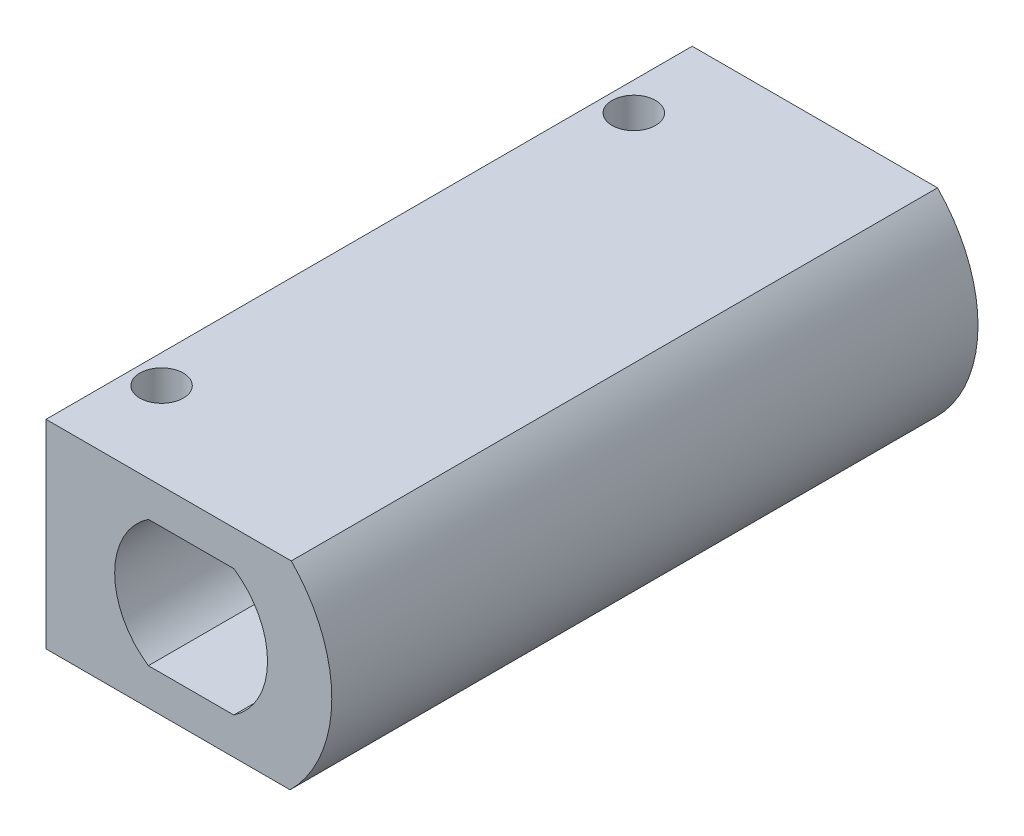
from build123d import *

# Parameters (mm, degrees)
SALIENTE_EXTRUIR1_DEPTH = 52
CROQUIS3_W              = 0.615681901
CROQUIS3_H              = 16
SALIENTE_EXTRUIR2_DEPTH = 52
CROQUIS2_R              = 1.75
CORTAR_EXTRUIR1_DEPTH   = 52
SALIENTE_EXTRUIR3_START = -52
SALIENTE_EXTRUIR3_DEPTH = 52
CROQUIS4_W              = 6.89100463
CROQUIS4_H              = 7.9059588
CORTAR_EXTRUIR2_DEPTH   = 10


with BuildPart() as part:
    # Croquis1 → Saliente-Extruir1 (new body)
    with BuildSketch(Plane.XY):
        with BuildLine():
            Line((-3.032251305, 15.708802589), (-22.152251305, 15.708802589))
            Line((-22.152251305, 15.708802589), (-22.152251305, -0.291197411))
            Line((-22.152251305, -0.291197411), (-3.132125677, -0.291197411))
            ThreePointArc((-3.132125677, -0.291197411), (-3.082032439, -0.241353267), (-3.032251305, -0.191197411))
            ThreePointArc((-3.032251305, -0.191197411), (0.228795467, 7.758802589), (-3.032251305, 15.708802589))
        make_face()
        with BuildLine():
            Line((-15.641976571, 13.908802589), (-6.542526038, 13.908802589))
            ThreePointArc((-6.542526038, 13.908802589), (-3.442251305, 7.758802589), (-6.542526038, 1.608802589))
            Line((-6.542526038, 1.608802589), (-15.641976571, 1.608802589))
            ThreePointArc((-15.641976571, 1.608802589), (-18.742251305, 7.758802589), (-15.641976571, 13.908802589))
        make_face(mode=Mode.SUBTRACT)
    extrude(amount=SALIENTE_EXTRUIR1_DEPTH)

    # Croquis3 → Saliente-Extruir2 (add)
    with BuildSketch(Plane.XY.offset(52)):
        with Locations((-22.460092256, 7.708802589)):
            Rectangle(CROQUIS3_W, CROQUIS3_H)
    extrude(amount=-SALIENTE_EXTRUIR2_DEPTH)

    # Croquis2 → Cortar-Extruir1 (cut)
    with BuildSketch(Plane(origin=(0, 15.708802589, 0), x_dir=(1, 0, 0), z_dir=(0, 1, 0))):
        with Locations(Location((-20.467933206, -7, 0), (0, 0, 270))):
            Circle(CROQUIS2_R)
        with Locations(Location((-20.467933206, -45, 0), (0, 0, 270))):
            Circle(CROQUIS2_R)
    extrude(amount=-CORTAR_EXTRUIR1_DEPTH, mode=Mode.SUBTRACT)

    # Croquis5 → Saliente-Extruir3 (add)
    with BuildSketch(Plane.XY.offset(52).offset(SALIENTE_EXTRUIR3_START)):
        with BuildLine():
            ThreePointArc((-17.242251305, 7.758802589), (-16.52178307, 10.647173203), (-14.529183076, 12.858802589))
            Line((-14.529183076, 12.858802589), (-16.794224647, 12.858802589))
            ThreePointArc((-16.794224647, 12.858802589), (-17.024621708, 12.588862775), (-17.242251305, 12.308527855))
            Line((-17.242251305, 12.308527855), (-17.242251305, 7.758802589))
        make_face()
        with BuildLine():
            Line((-17.242251305, 3.209077323), (-17.242251305, 7.758802589))
            Line((-17.242251305, 7.758802589), (-17.242251305, 12.308527855))
            ThreePointArc((-17.242251305, 12.308527855), (-18.742251305, 7.758802589), (-17.242251305, 3.209077323))
        make_face()
        with BuildLine():
            Line((-16.794224647, 12.858802589), (-14.529183076, 12.858802589))
            ThreePointArc((-14.529183076, 12.858802589), (-12.889123587, 13.640447767), (-11.092251305, 13.908802589))
            Line((-11.092251305, 13.908802589), (-15.641976571, 13.908802589))
            ThreePointArc((-15.641976571, 13.908802589), (-16.244916255, 13.413229519), (-16.794224647, 12.858802589))
        make_face()
        with BuildLine():
            Line((-7.655319533, 12.858802589), (-5.390277962, 12.858802589))
            ThreePointArc((-5.390277962, 12.858802589), (-5.939586354, 13.413229519), (-6.542526038, 13.908802589))
            Line((-6.542526038, 13.908802589), (-11.092251305, 13.908802589))
            ThreePointArc((-11.092251305, 13.908802589), (-9.295379022, 13.640447767), (-7.655319533, 12.858802589))
        make_face()
        with BuildLine():
            ThreePointArc((-4.942251305, 12.308527855), (-5.159880902, 12.588862775), (-5.390277962, 12.858802589))
            Line((-5.390277962, 12.858802589), (-7.655319533, 12.858802589))
            ThreePointArc((-7.655319533, 12.858802589), (-5.662719539, 10.647173203), (-4.942251305, 7.758802589))
            Line((-4.942251305, 7.758802589), (-4.942251305, 12.308527855))
        make_face()
        with BuildLine():
            ThreePointArc((-3.442251305, 7.758802589), (-3.826922682, 10.154110502), (-4.942251305, 12.308527855))
            Line((-4.942251305, 12.308527855), (-4.942251305, 7.758802589))
            Line((-4.942251305, 7.758802589), (-4.942251305, 3.209077323))
            ThreePointArc((-4.942251305, 3.209077323), (-3.826922682, 5.363494676), (-3.442251305, 7.758802589))
        make_face()
        with BuildLine():
            Line((-4.942251305, 3.209077323), (-4.942251305, 7.758802589))
            ThreePointArc((-4.942251305, 7.758802589), (-5.662719539, 4.870431975), (-7.655319533, 2.658802589))
            Line((-7.655319533, 2.658802589), (-5.390277962, 2.658802589))
            ThreePointArc((-5.390277962, 2.658802589), (-5.159880902, 2.928742403), (-4.942251305, 3.209077323))
        make_face()
        with BuildLine():
            Line((-5.390277962, 2.658802589), (-7.655319533, 2.658802589))
            ThreePointArc((-7.655319533, 2.658802589), (-9.295379026, 1.87715741), (-11.092251313, 1.608802589))
            Line((-11.092251313, 1.608802589), (-6.542526038, 1.608802589))
            ThreePointArc((-6.542526038, 1.608802589), (-5.939586354, 2.104375659), (-5.390277962, 2.658802589))
        make_face()
        with BuildLine():
            ThreePointArc((-11.092251313, 1.608802589), (-9.295379026, 1.87715741), (-7.655319533, 2.658802589))
            Line((-7.655319533, 2.658802589), (-14.529183076, 2.658802589))
            ThreePointArc((-14.529183076, 2.658802589), (-12.889123591, 1.877157412), (-11.092251313, 1.608802589))
        make_face()
        with BuildLine():
            ThreePointArc((-11.092251313, 1.608802589), (-12.889123591, 1.877157412), (-14.529183076, 2.658802589))
            Line((-14.529183076, 2.658802589), (-16.794224647, 2.658802589))
            ThreePointArc((-16.794224647, 2.658802589), (-16.244916255, 2.104375659), (-15.641976571, 1.608802589))
            Line((-15.641976571, 1.608802589), (-11.092251313, 1.608802589))
        make_face()
        with BuildLine():
            ThreePointArc((-14.529183076, 2.658802589), (-16.52178307, 4.870431975), (-17.242251305, 7.758802589))
            Line((-17.242251305, 7.758802589), (-17.242251305, 3.209077323))
            ThreePointArc((-17.242251305, 3.209077323), (-17.024621708, 2.928742403), (-16.794224647, 2.658802589))
            Line((-16.794224647, 2.658802589), (-14.529183076, 2.658802589))
        make_face()
        with BuildLine():
            Line((-6.542526038, 1.608802589), (-11.092251313, 1.608802589))
            Line((-11.092251313, 1.608802589), (-15.641976571, 1.608802589))
            ThreePointArc((-15.641976571, 1.608802589), (-11.092251305, 0.108802589), (-6.542526038, 1.608802589))
        make_face()
        with BuildLine():
            Line((-11.092251305, 13.908802589), (-6.542526038, 13.908802589))
            ThreePointArc((-6.542526038, 13.908802589), (-11.092251305, 15.408802589), (-15.641976571, 13.908802589))
            Line((-15.641976571, 13.908802589), (-11.092251305, 13.908802589))
        make_face()
        with BuildLine():
            Line((-14.529183076, 12.858802589), (-7.655319533, 12.858802589))
            ThreePointArc((-7.655319533, 12.858802589), (-9.295379022, 13.640447767), (-11.092251305, 13.908802589))
            ThreePointArc((-11.092251305, 13.908802589), (-12.889123587, 13.640447767), (-14.529183076, 12.858802589))
        make_face()
    extrude(amount=SALIENTE_EXTRUIR3_DEPTH)

    # Croquis4 → Cortar-Extruir2 (cut)
    with BuildSketch(Plane.ZY.offset(22.767933206)):
        with Locations((26, 7.708802589)):
            Rectangle(CROQUIS4_W, CROQUIS4_H)
    extrude(amount=-CORTAR_EXTRUIR2_DEPTH, mode=Mode.SUBTRACT)


solid = part.part
